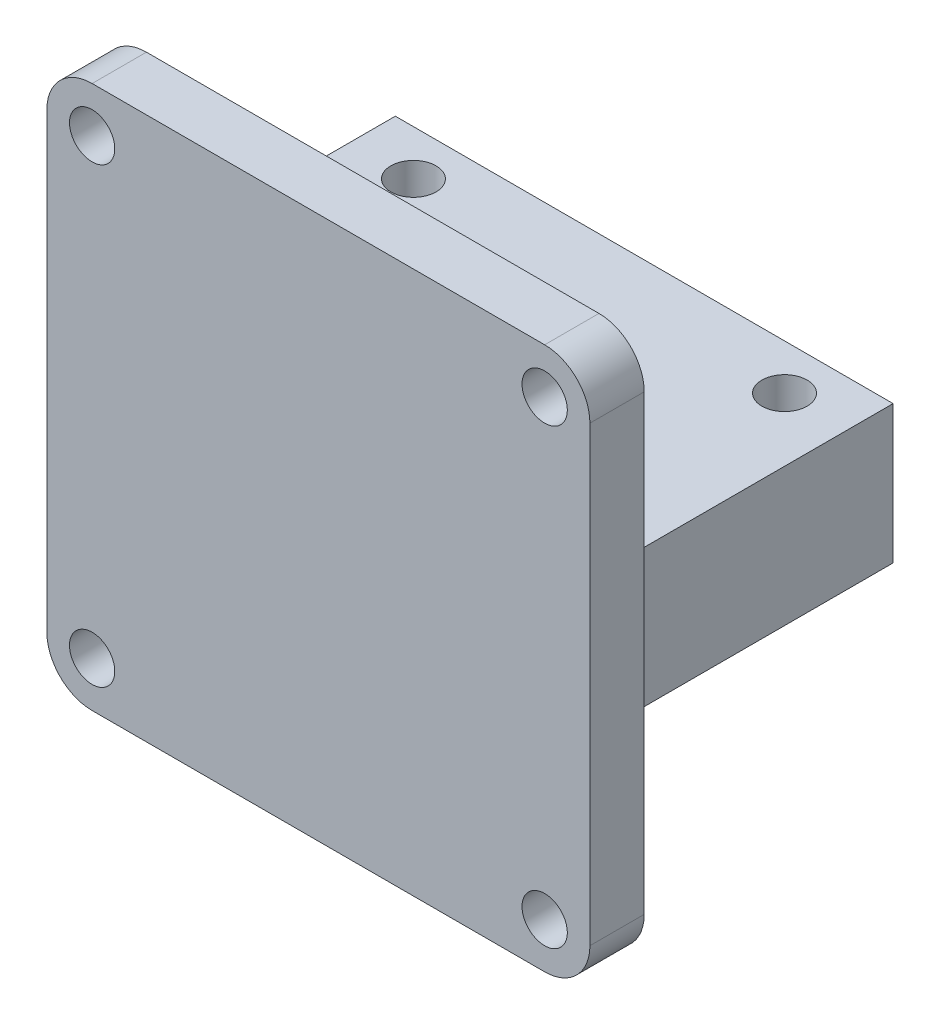
from build123d import *

# Parameters (mm, degrees)
SKETCH1_W             = 60
SKETCH1_H             = 60
BOSS_EXTRUDE1_DEPTH   = 6
SKETCH2_W             = 55
SKETCH2_H             = 15.25
BOSS_EXTRUDE2_DEPTH   = 30
F_5_0MM_DOWEL_HOLE1_D = 5
FILLET1_R             = 5
F_5_0MM_DOWEL_HOLE2_D = 5


with BuildPart() as part:
    # Sketch1 → Boss-Extrude1 (new body)
    with BuildSketch(Plane.XY):
        Rectangle(SKETCH1_W, SKETCH1_H)
    extrude(amount=BOSS_EXTRUDE1_DEPTH)

    # Sketch2 → Boss-Extrude2 (add)
    with BuildSketch(Plane(origin=(0, 0, 0), x_dir=(-1, 0, 0), z_dir=(0, 0, -1))):
        Rectangle(SKETCH2_W, SKETCH2_H)
    extrude(amount=BOSS_EXTRUDE2_DEPTH)

    # Ø5.0mm Dowel Hole1 (through all)
    with Locations(Plane(origin=(0, 0, 0), x_dir=(-1, 0, 0), z_dir=(0, 0, -1))):
        with Locations((25, 25), (-25, 25), (25, -25), (-25, -25)):
            Hole(F_5_0MM_DOWEL_HOLE1_D / 2)

    # Fillet1
    fillet1_edges = [part.edges().sort_by_distance(p)[0] for p in [
        (30, -30, 3),
        (-30, -30, 3),
        (-30, 30, 3),
        (30, 30, 3),
    ]]
    fillet(fillet1_edges, radius=FILLET1_R)

    # Ø5.0mm Dowel Hole2 (through all)
    with Locations(Plane(origin=(0, 7.625, 0), x_dir=(1, 0, 0), z_dir=(0, 1, 0))):
        with Locations((20.5, 25), (20.5, 5), (-20.5, 5), (-20.5, 25)):
            Hole(F_5_0MM_DOWEL_HOLE2_D / 2)


solid = part.part
